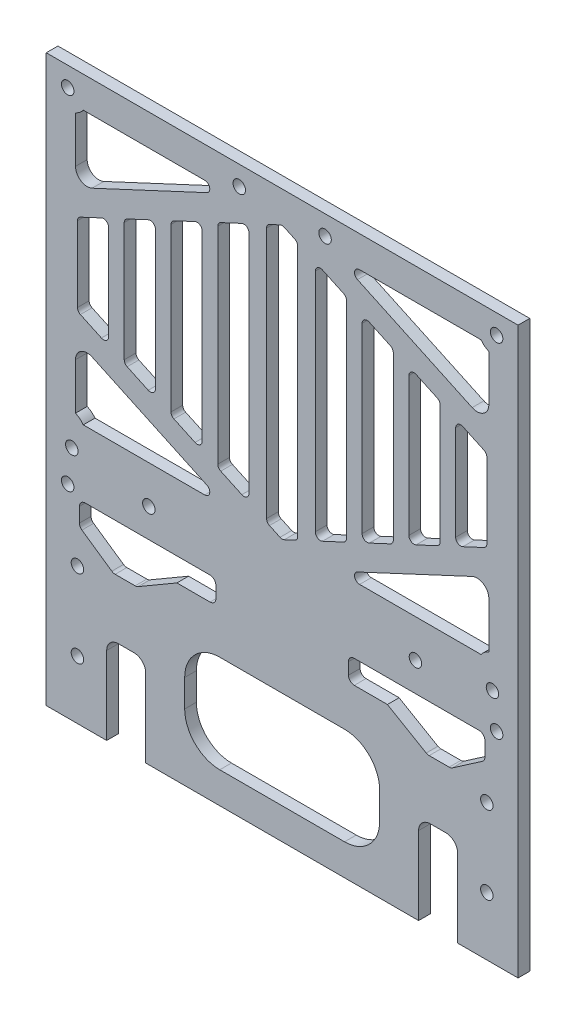
from build123d import *

# Parameters (mm, degrees)
SKETCH_1_W             = 121
SKETCH_1_H             = 145
EXTRUDE_1_DEPTH        = 3
CUT_EXTRUDE_1_DEPTH    = 95.474864382
FILLET_1_R             = 1.5
FILLET_1_OF_MIRROR_1_R = 1.5
SKETCH_3_R             = 1.6
CUT_EXTRUDE_2_DEPTH    = 95.474864382
SKETCH_4_R             = 1.6
CUT_EXTRUDE_3_DEPTH    = 95.474864382
SKETCH_5_R             = 1.6
CUT_EXTRUDE_4_DEPTH    = 95.474864382
SKETCH_6_R             = 1.6
CUT_EXTRUDE_5_DEPTH    = 95.474864382
CUT_EXTRUDE_6_DEPTH    = 95.474864382
FILLET_2_R             = 1.3
CUT_EXTRUDE_7_DEPTH    = 95.474864382
FILLET_3_R             = 1.3
FILLET_4_R             = 3
SKETCH_10_W            = 10
SKETCH_10_H            = 23
CUT_EXTRUDE_8_DEPTH    = 95.474864382
FILLET_5_R             = 3
SKETCH_11_W            = 50
SKETCH_11_H            = 25
CUT_EXTRUDE_9_DEPTH    = 95.474864382
FILLET_6_R             = 9
SKETCH_12_R            = 1.6
CUT_EXTRUDE_10_DEPTH   = 95.474864382


with BuildPart() as part:
    # 草图1 → 凸台-拉伸1 (new body)
    with BuildSketch(Plane.XY):
        Rectangle(SKETCH_1_W, SKETCH_1_H)
    extrude(amount=EXTRUDE_1_DEPTH)

    # 草图2 → 切除-拉伸1 (cut, through all)
    with BuildSketch(Plane.XY.offset(3)):
        Polygon((-27, -28.5), (-17, -28.5), (-17, -22.5), (-52, -22.5), (-52, -28.5), (-43.3, -34.5), (-37.3, -34.5), align=None)
    cut_extrude_1 = extrude(amount=-CUT_EXTRUDE_1_DEPTH, mode=Mode.SUBTRACT)

    # 圆角1
    fillet_1_edges = [part.edges().sort_by_distance(p)[0] for p in [
        (-17, -28.5, 1.5),
        (-17, -22.5, 1.5),
        (-52, -22.5, 1.5),
        (-37.3, -34.5, 1.5),
        (-43.3, -34.5, 1.5),
        (-52, -28.5, 1.5),
    ]]
    fillet(fillet_1_edges, radius=FILLET_1_R)

    # 镜向1: 切除-拉伸1 across plane
    add(cut_extrude_1.mirror(Plane(origin=(0, 0, 0), x_dir=(0, 0, 1), z_dir=(1, 0, 0))), mode=Mode.SUBTRACT)

    # 圆角1 of 镜向1
    fillet_1_of_mirror_1_edges = [part.edges().sort_by_distance(p)[0] for p in [
        (17, -28.5, 1.5),
        (17, -22.5, 1.5),
        (52, -22.5, 1.5),
        (37.3, -34.5, 1.5),
        (43.3, -34.5, 1.5),
        (52, -28.5, 1.5),
    ]]
    fillet(fillet_1_of_mirror_1_edges, radius=FILLET_1_OF_MIRROR_1_R)

    # 草图3 → 切除-拉伸2 (cut, through all)
    with BuildSketch(Plane.XY.offset(3)):
        with Locations((-55, -20.5)):
            Circle(SKETCH_3_R)
        with Locations((55, -20.5)):
            Circle(SKETCH_3_R)
    extrude(amount=-CUT_EXTRUDE_2_DEPTH, mode=Mode.SUBTRACT)

    # 草图4 → 切除-拉伸3 (cut, through all)
    with BuildSketch(Plane.XY.offset(3)):
        with Locations((-53.94, -11.96)):
            Circle(SKETCH_4_R)
        with Locations((-34.186233188, -15.088689301)):
            Circle(SKETCH_4_R)
        with Locations((34.186233188, -15.088689301)):
            Circle(SKETCH_4_R)
        with Locations((53.94, -11.96)):
            Circle(SKETCH_4_R)
    extrude(amount=-CUT_EXTRUDE_3_DEPTH, mode=Mode.SUBTRACT)

    # 草图5 → 切除-拉伸4 (cut, through all)
    with BuildSketch(Plane(origin=(0, 0, 0), x_dir=(-1, 0, 0), z_dir=(0, 0, -1))):
        with Locations((52.5, -57.5)):
            Circle(SKETCH_5_R)
        with Locations((52.5, -37.5)):
            Circle(SKETCH_5_R)
        with Locations((-52.5, -57.5)):
            Circle(SKETCH_5_R)
        with Locations((-52.5, -37.5)):
            Circle(SKETCH_5_R)
    extrude(amount=-CUT_EXTRUDE_4_DEPTH, mode=Mode.SUBTRACT)

    # 草图6 → 切除-拉伸5 (cut, through all)
    with BuildSketch(Plane.XY.offset(3)):
        with Locations((-55, 67.5)):
            Circle(SKETCH_6_R)
        with Locations((55, 67.5)):
            Circle(SKETCH_6_R)
    extrude(amount=-CUT_EXTRUDE_5_DEPTH, mode=Mode.SUBTRACT)

    # 草图7 → 切除-拉伸6 (cut, through all)
    with BuildSketch(Plane.XY.offset(3)):
        Polygon((-8.5, -1.431304328), (-8.5, 60.536384906), (-16.5, 56.80592364), (-16.5, 2.299156937), align=None)
        Polygon((4, 62.634769367), (0, 64.5), (-4, 62.634769367), (-4, -3.52968879), (0, -5.394919423), (4, -3.52968879), align=None)
        Polygon((-20.5, 4.16438757), (-20.5, 54.940693008), (-28.5, 51.210231743), (-28.5, 7.894848835), align=None)
        Polygon((-32.5, 9.760079467), (-32.5, 49.34500111), (-40.5, 45.614539845), (-40.5, 13.490540733), align=None)
        Polygon((-44.5, 15.355771365), (-44.5, 43.749309212), (-52.5, 40.018847947), (-52.5, 19.086232631), align=None)
        Polygon((52.5, 19.086232631), (52.5, 40.018847947), (44.5, 43.749309212), (44.5, 15.355771365), align=None)
        Polygon((40.5, 13.490540733), (40.5, 45.614539845), (32.5, 49.34500111), (32.5, 9.760079467), align=None)
        Polygon((20.5, 54.940693008), (20.5, 4.16438757), (28.5, 7.894848835), (28.5, 51.210231743), align=None)
        Polygon((16.5, 2.299156937), (16.5, 56.80592364), (8.5, 60.536384906), (8.5, -1.431304328), align=None)
    extrude(amount=-CUT_EXTRUDE_6_DEPTH, mode=Mode.SUBTRACT)

    # 圆角2
    fillet_2_edges = [part.edges().sort_by_distance(p)[0] for p in [
        (44.5, 43.749309212, 1.5),
        (32.5, 49.34500111, 1.5),
        (20.5, 54.940693008, 1.5),
        (8.5, 60.536384906, 1.5),
        (-4, 62.634769367, 1.5),
        (44.5, 15.355771365, 1.5),
        (32.5, 9.760079467, 1.5),
        (20.5, 4.16438757, 1.5),
        (8.5, -1.431304328, 1.5),
        (-4, -3.52968879, 1.5),
        (-16.5, 2.299156937, 1.5),
        (-28.5, 7.894848835, 1.5),
        (-40.5, 13.490540733, 1.5),
        (52.5, 40.018847947, 1.5),
        (40.5, 45.614539845, 1.5),
        (28.5, 51.210231743, 1.5),
        (16.5, 56.80592364, 1.5),
        (4, 62.634769367, 1.5),
        (52.5, 19.086232631, 1.5),
        (40.5, 13.490540733, 1.5),
        (28.5, 7.894848835, 1.5),
        (16.5, 2.299156937, 1.5),
        (4, -3.52968879, 1.5),
        (0, -5.394919423, 1.5),
        (-8.5, -1.431304328, 1.5),
        (-20.5, 4.16438757, 1.5),
        (-32.5, 9.760079467, 1.5),
        (-44.5, 15.355771365, 1.5),
        (-52.5, 19.086232631, 1.5),
        (-28.5, 51.210231743, 1.5),
        (-52.5, 40.018847947, 1.5),
        (-44.5, 43.749309212, 1.5),
        (-20.5, 54.940693008, 1.5),
        (-32.5, 49.34500111, 1.5),
        (-40.5, 45.614539845, 1.5),
        (-16.5, 56.80592364, 1.5),
        (-8.5, 60.536384906, 1.5),
        (0, 64.5, 1.5),
    ]]
    fillet(fillet_2_edges, radius=FILLET_2_R)

    # 草图8 → 切除-拉伸7 (cut, through all)
    with BuildSketch(Plane(origin=(0, 0, 0), x_dir=(-1, 0, 0), z_dir=(0, 0, -1))):
        with BuildLine():
            Line((-53, 46.314001332), (-14, 64.5))
            Line((-14, 64.5), (-51, 64.5))
            ThreePointArc((-51, 64.5), (-51.897398437, 63.579048133), (-53, 62.917424305))
            Line((-53, 62.917424305), (-53, 46.314001332))
        make_face()
        with BuildLine():
            Line((53, 46.314001332), (53, 62.917424305))
            ThreePointArc((53, 62.917424305), (51.897398437, 63.579048133), (51, 64.5))
            Line((51, 64.5), (14, 64.5))
            Line((14, 64.5), (53, 46.314001332))
        make_face()
        with BuildLine():
            Line((53, 12.791079245), (14, -5.394919423))
            Line((14, -5.394919423), (51, -5.394919423))
            ThreePointArc((51, -5.394919423), (51.897398437, -4.473967556), (53, -3.812343728))
            Line((53, -3.812343728), (53, 12.791079245))
        make_face()
        with BuildLine():
            Line((-53, 12.791079245), (-53, -3.812343728))
            ThreePointArc((-53, -3.812343728), (-51.897398437, -4.473967556), (-51, -5.394919423))
            Line((-51, -5.394919423), (-14, -5.394919423))
            Line((-14, -5.394919423), (-53, 12.791079245))
        make_face()
    extrude(amount=-CUT_EXTRUDE_7_DEPTH, mode=Mode.SUBTRACT)

    # 圆角3
    fillet_3_edges = [part.edges().sort_by_distance(p)[0] for p in [
        (14, -5.394919423, 1.5),
        (-14, -5.394919423, 1.5),
        (-14, 64.5, 1.5),
        (14, 64.5, 1.5),
    ]]
    fillet(fillet_3_edges, radius=FILLET_3_R)

    # 圆角4
    fillet_4_edges = [part.edges().sort_by_distance(p)[0] for p in [
        (-53, 46.314001332, 1.5),
        (-53, 12.791079245, 1.5),
        (53, 12.791079245, 1.5),
        (53, 46.314001332, 1.5),
    ]]
    fillet(fillet_4_edges, radius=FILLET_4_R)

    # 草图10 → 切除-拉伸8 (cut, through all)
    with BuildSketch(Plane(origin=(0, 0, 0), x_dir=(-1, 0, 0), z_dir=(0, 0, -1))):
        with Locations((-40, -61)):
            Rectangle(SKETCH_10_W, SKETCH_10_H)
        with Locations((40, -61)):
            Rectangle(SKETCH_10_W, SKETCH_10_H)
    extrude(amount=-CUT_EXTRUDE_8_DEPTH, mode=Mode.SUBTRACT)

    # 圆角5
    fillet_5_edges = [part.edges().sort_by_distance(p)[0] for p in [
        (-45, -49.5, 1.5),
        (-35, -49.5, 1.5),
        (35, -49.5, 1.5),
        (45, -49.5, 1.5),
    ]]
    fillet(fillet_5_edges, radius=FILLET_5_R)

    # 草图11 → 切除-拉伸9 (cut, through all)
    with BuildSketch(Plane(origin=(0, 0, 0), x_dir=(-1, 0, 0), z_dir=(0, 0, -1))):
        with Locations((0, -52)):
            Rectangle(SKETCH_11_W, SKETCH_11_H)
    extrude(amount=-CUT_EXTRUDE_9_DEPTH, mode=Mode.SUBTRACT)

    # 圆角6
    fillet_6_edges = [part.edges().sort_by_distance(p)[0] for p in [
        (-25, -64.5, 1.5),
        (25, -64.5, 1.5),
        (-25, -39.5, 1.5),
        (25, -39.5, 1.5),
    ]]
    fillet(fillet_6_edges, radius=FILLET_6_R)

    # 草图12 → 切除-拉伸10 (cut, through all)
    with BuildSketch(Plane(origin=(0, 0, 0), x_dir=(-1, 0, 0), z_dir=(0, 0, -1))):
        with Locations((-11, 67.5)):
            Circle(SKETCH_12_R)
        with Locations((11, 67.5)):
            Circle(SKETCH_12_R)
    extrude(amount=-CUT_EXTRUDE_10_DEPTH, mode=Mode.SUBTRACT)


solid = part.part
